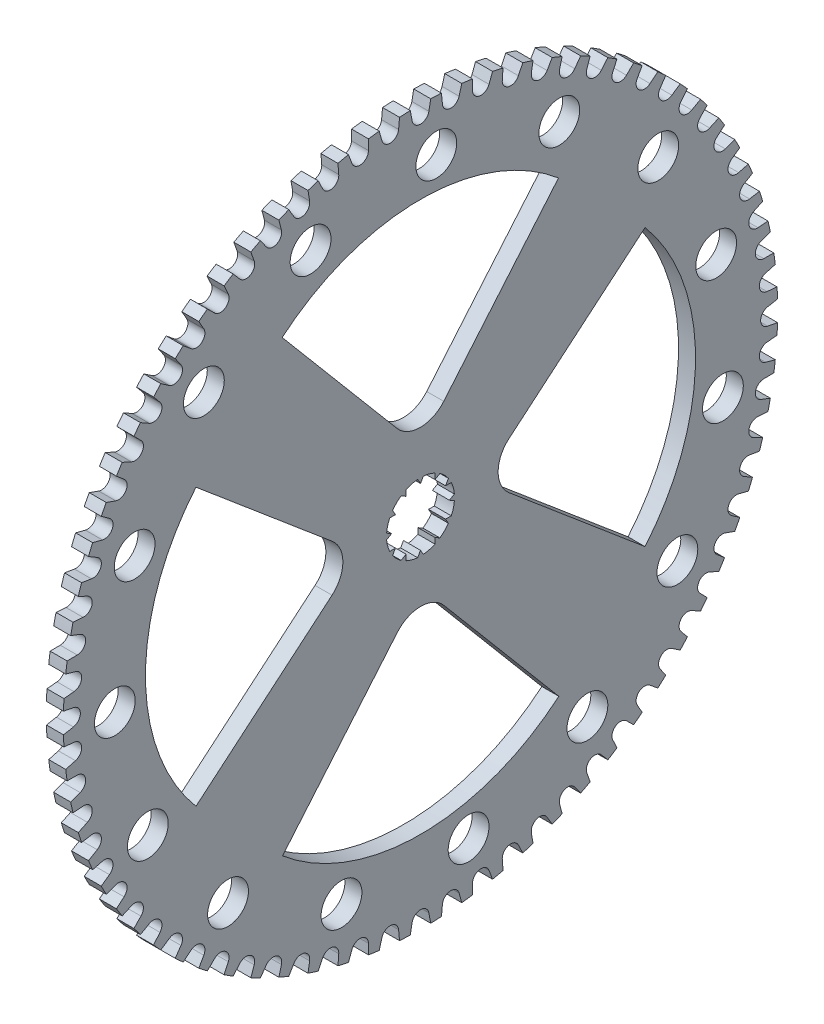
from build123d import *

# Parameters (mm, degrees)
SKETCH1_R               = 105
BOSS_EXTRUDE1_DEPTH     = 5
CUT_EXTRUDE4_DEPTH      = 10
CUT_EXTRUDE2_DEPTH      = 134
CUT_EXTRUDE2_DEPTH_BACK = 36
CUT_EXTRUDE3_DEPTH      = 43
CUT_EXTRUDE3_DEPTH_BACK = 16
SKETCH5_R               = 6


with BuildPart() as part:
    # Sketch1 → Boss-Extrude1 (new body)
    with BuildSketch(Plane(origin=(0, 0, 0), x_dir=(0, 0, -1), z_dir=(1, 0, 0))):
        Circle(SKETCH1_R)
    extrude(amount=BOSS_EXTRUDE1_DEPTH)

    # Sketch3 → Cut-Extrude4 (cut)
    with BuildSketch(Plane.ZY):
        with BuildLine():
            Line((-2.45783116, 102.042762654), (-3, 104.957134107))
            ThreePointArc((-3, 104.957134107), (0, 105), (3, 104.957134107))
            Line((3, 104.957134107), (2.45783116, 102.042762654))
            ThreePointArc((2.45783116, 102.042762654), (0, 100), (-2.45783116, 102.042762654))
        make_face()
        with BuildLine():
            Line((6.445134401, 101.868673234), (6.159032886, 104.819207753))
            ThreePointArc((6.159032886, 104.819207753), (9.151352989, 104.6004433), (12.136201074, 104.296273296))
            Line((12.136201074, 104.296273296), (11.342091141, 101.440245034))
            ThreePointArc((11.342091141, 101.440245034), (8.715574275, 99.619469809), (6.445134401, 101.868673234))
        make_face()
        with BuildLine():
            Line((15.299048597, 100.919301702), (15.271191812, 103.883543936))
            ThreePointArc((15.271191812, 103.883543936), (18.233058655, 103.404814066), (21.18003833, 102.84165487))
            Line((21.18003833, 102.84165487), (20.14003096, 100.065705898))
            ThreePointArc((20.14003096, 100.065705898), (17.364817767, 98.480775301), (15.299048597, 100.919301702))
        make_face()
        with BuildLine():
            Line((24.036527796, 99.201873347), (24.267127747, 102.157263623))
            ThreePointArc((24.267127747, 102.157263623), (27.175999736, 101.42221176), (30.062682705, 100.604349352))
            Line((30.062682705, 100.604349352), (28.784692983, 97.929606319))
            ThreePointArc((28.784692983, 97.929606319), (25.88190451, 96.592582629), (24.036527796, 99.201873347))
        make_face()
        with BuildLine():
            Line((32.591074504, 96.729458836), (33.078376188, 99.653504849))
            ThreePointArc((33.078376188, 99.653504849), (35.912115049, 98.667725183), (38.716531913, 97.601383989))
            Line((38.716531913, 97.601383989), (37.210286112, 95.048203305))
            ThreePointArc((37.210286112, 95.048203305), (34.202014333, 93.969262079), (32.591074504, 96.729458836))
        make_face()
        with BuildLine():
            Line((40.897583457, 93.520874736), (41.637878213, 96.391322732))
            ThreePointArc((41.637878213, 96.391322732), (44.374917483, 95.162317639), (47.075724935, 93.855613161))
            Line((47.075724935, 93.855613161), (45.352686495, 91.443426071))
            ThreePointArc((45.352686495, 91.443426071), (42.261826174, 90.630778704), (40.897583457, 93.520874736))
        make_face()
        with BuildLine():
            Line((48.892837104, 89.60054031), (49.880490842, 92.395544445))
            ThreePointArc((49.880490842, 92.395544445), (52.5, 90.932667397), (55.076643265, 89.395544445))
            Line((55.076643265, 89.395544445), (53.149925549, 87.142709151))
            ThreePointArc((53.149925549, 87.142709151), (50, 86.602540378), (48.892837104, 89.60054031))
        make_face()
        with BuildLine():
            Line((56.515986739, 84.99829167), (57.743482818, 87.696580276))
            ThreePointArc((57.743482818, 87.696580276), (60.225525817, 86.01096465), (62.658395084, 84.255121658))
            Line((62.658395084, 84.255121658), (60.542661577, 82.178783595))
            ThreePointArc((60.542661577, 82.178783595), (57.357643635, 81.915204429), (56.515986739, 84.99829167))
        make_face()
        with BuildLine():
            Line((63.70901559, 79.749154707), (65.167012023, 82.330192178))
            ThreePointArc((65.167012023, 82.330192178), (67.492699017, 80.434666527), (69.763278682, 78.473466519))
            Line((69.763278682, 78.473466519), (67.474631394, 76.589427875))
            ThreePointArc((67.474631394, 76.589427875), (64.278760969, 76.604444312), (63.70901559, 79.749154707))
        make_face()
        with BuildLine():
            Line((70.417180363, 73.893078523), (72.094580918, 76.337221605))
            ThreePointArc((72.094580918, 76.337221605), (74.246212025, 74.246212025), (76.337221605, 72.094580918))
            Line((76.337221605, 72.094580918), (73.893078523, 70.417180363))
            ThreePointArc((73.893078523, 70.417180363), (70.710678119, 70.710678119), (70.417180363, 73.893078523))
        make_face()
        with BuildLine():
            Line((76.589427875, 67.474631394), (78.473466519, 69.763278682))
            ThreePointArc((78.473466519, 69.763278682), (80.434666527, 67.492699017), (82.330192178, 65.167012023))
            Line((82.330192178, 65.167012023), (79.749154707, 63.70901559))
            ThreePointArc((79.749154707, 63.70901559), (76.604444312, 64.278760969), (76.589427875, 67.474631394))
        make_face()
        with BuildLine():
            Line((82.178783595, 60.542661577), (84.255121658, 62.658395084))
            ThreePointArc((84.255121658, 62.658395084), (86.01096465, 60.225525817), (87.696580276, 57.743482818))
            Line((87.696580276, 57.743482818), (84.99829167, 56.515986739))
            ThreePointArc((84.99829167, 56.515986739), (81.915204429, 57.357643635), (82.178783595, 60.542661577))
        make_face()
        with BuildLine():
            Line((87.142709151, 53.149925549), (89.395544445, 55.076643265))
            ThreePointArc((89.395544445, 55.076643265), (90.932667397, 52.5), (92.395544445, 49.880490842))
            Line((92.395544445, 49.880490842), (89.60054031, 48.892837104))
            ThreePointArc((89.60054031, 48.892837104), (86.602540378, 50), (87.142709151, 53.149925549))
        make_face()
        with BuildLine():
            Line((91.443426071, 45.352686495), (93.855613161, 47.075724935))
            ThreePointArc((93.855613161, 47.075724935), (95.162317639, 44.374917483), (96.391322732, 41.637878213))
            Line((96.391322732, 41.637878213), (93.520874736, 40.897583457))
            ThreePointArc((93.520874736, 40.897583457), (90.630778704, 42.261826174), (91.443426071, 45.352686495))
        make_face()
        with BuildLine():
            Line((95.048203305, 37.210286112), (97.601383989, 38.716531913))
            ThreePointArc((97.601383989, 38.716531913), (98.667725183, 35.912115049), (99.653504849, 33.078376188))
            Line((99.653504849, 33.078376188), (96.729458836, 32.591074504))
            ThreePointArc((96.729458836, 32.591074504), (93.969262079, 34.202014333), (95.048203305, 37.210286112))
        make_face()
        with BuildLine():
            Line((97.929606319, 28.784692983), (100.604349352, 30.062682705))
            ThreePointArc((100.604349352, 30.062682705), (101.42221176, 27.175999736), (102.157263623, 24.267127747))
            Line((102.157263623, 24.267127747), (99.201873347, 24.036527796))
            ThreePointArc((99.201873347, 24.036527796), (96.592582629, 25.88190451), (97.929606319, 28.784692983))
        make_face()
        with BuildLine():
            Line((100.065705898, 20.14003096), (102.84165487, 21.18003833))
            ThreePointArc((102.84165487, 21.18003833), (103.404814066, 18.233058655), (103.883543936, 15.271191812))
            Line((103.883543936, 15.271191812), (100.919301702, 15.299048597))
            ThreePointArc((100.919301702, 15.299048597), (98.480775301, 17.364817767), (100.065705898, 20.14003096))
        make_face()
        with BuildLine():
            Line((101.440245034, 11.342091141), (104.296273296, 12.136201074))
            ThreePointArc((104.296273296, 12.136201074), (104.6004433, 9.151352989), (104.819207753, 6.159032886))
            Line((104.819207753, 6.159032886), (101.868673234, 6.445134401))
            ThreePointArc((101.868673234, 6.445134401), (99.619469809, 8.715574275), (101.440245034, 11.342091141))
        make_face()
        with BuildLine():
            Line((102.042762654, 2.45783116), (104.957134107, 3))
            ThreePointArc((104.957134107, 3), (105, 0), (104.957134107, -3))
            Line((104.957134107, -3), (102.042762654, -2.45783116))
            ThreePointArc((102.042762654, -2.45783116), (100, 0), (102.042762654, 2.45783116))
        make_face()
        with BuildLine():
            Line((101.868673234, -6.445134401), (104.819207753, -6.159032886))
            ThreePointArc((104.819207753, -6.159032886), (104.6004433, -9.151352989), (104.296273296, -12.136201074))
            Line((104.296273296, -12.136201074), (101.440245034, -11.342091141))
            ThreePointArc((101.440245034, -11.342091141), (99.619469809, -8.715574275), (101.868673234, -6.445134401))
        make_face()
        with BuildLine():
            Line((100.919301702, -15.299048597), (103.883543936, -15.271191812))
            ThreePointArc((103.883543936, -15.271191812), (103.404814066, -18.233058655), (102.84165487, -21.18003833))
            Line((102.84165487, -21.18003833), (100.065705898, -20.14003096))
            ThreePointArc((100.065705898, -20.14003096), (98.480775301, -17.364817767), (100.919301702, -15.299048597))
        make_face()
        with BuildLine():
            Line((99.201873347, -24.036527796), (102.157263623, -24.267127747))
            ThreePointArc((102.157263623, -24.267127747), (101.42221176, -27.175999736), (100.604349352, -30.062682705))
            Line((100.604349352, -30.062682705), (97.929606319, -28.784692983))
            ThreePointArc((97.929606319, -28.784692983), (96.592582629, -25.88190451), (99.201873347, -24.036527796))
        make_face()
        with BuildLine():
            Line((96.729458836, -32.591074504), (99.653504849, -33.078376188))
            ThreePointArc((99.653504849, -33.078376188), (98.667725183, -35.912115049), (97.601383989, -38.716531913))
            Line((97.601383989, -38.716531913), (95.048203305, -37.210286112))
            ThreePointArc((95.048203305, -37.210286112), (93.969262079, -34.202014333), (96.729458836, -32.591074504))
        make_face()
        with BuildLine():
            Line((93.520874736, -40.897583457), (96.391322732, -41.637878213))
            ThreePointArc((96.391322732, -41.637878213), (95.162317639, -44.374917483), (93.855613161, -47.075724935))
            Line((93.855613161, -47.075724935), (91.443426071, -45.352686495))
            ThreePointArc((91.443426071, -45.352686495), (90.630778704, -42.261826174), (93.520874736, -40.897583457))
        make_face()
        with BuildLine():
            Line((89.60054031, -48.892837104), (92.395544445, -49.880490842))
            ThreePointArc((92.395544445, -49.880490842), (90.932667397, -52.5), (89.395544445, -55.076643265))
            Line((89.395544445, -55.076643265), (87.142709151, -53.149925549))
            ThreePointArc((87.142709151, -53.149925549), (86.602540378, -50), (89.60054031, -48.892837104))
        make_face()
        with BuildLine():
            Line((84.99829167, -56.515986739), (87.696580276, -57.743482818))
            ThreePointArc((87.696580276, -57.743482818), (86.01096465, -60.225525817), (84.255121658, -62.658395084))
            Line((84.255121658, -62.658395084), (82.178783595, -60.542661577))
            ThreePointArc((82.178783595, -60.542661577), (81.915204429, -57.357643635), (84.99829167, -56.515986739))
        make_face()
        with BuildLine():
            Line((79.749154707, -63.70901559), (82.330192178, -65.167012023))
            ThreePointArc((82.330192178, -65.167012023), (80.434666527, -67.492699017), (78.473466519, -69.763278682))
            Line((78.473466519, -69.763278682), (76.589427875, -67.474631394))
            ThreePointArc((76.589427875, -67.474631394), (76.604444312, -64.278760969), (79.749154707, -63.70901559))
        make_face()
        with BuildLine():
            Line((73.893078523, -70.417180363), (76.337221605, -72.094580918))
            ThreePointArc((76.337221605, -72.094580918), (74.246212025, -74.246212025), (72.094580918, -76.337221605))
            Line((72.094580918, -76.337221605), (70.417180363, -73.893078523))
            ThreePointArc((70.417180363, -73.893078523), (70.710678119, -70.710678119), (73.893078523, -70.417180363))
        make_face()
        with BuildLine():
            Line((67.474631394, -76.589427875), (69.763278682, -78.473466519))
            ThreePointArc((69.763278682, -78.473466519), (67.492699017, -80.434666527), (65.167012023, -82.330192178))
            Line((65.167012023, -82.330192178), (63.70901559, -79.749154707))
            ThreePointArc((63.70901559, -79.749154707), (64.278760969, -76.604444312), (67.474631394, -76.589427875))
        make_face()
        with BuildLine():
            Line((60.542661577, -82.178783595), (62.658395084, -84.255121658))
            ThreePointArc((62.658395084, -84.255121658), (60.225525817, -86.01096465), (57.743482818, -87.696580276))
            Line((57.743482818, -87.696580276), (56.515986739, -84.99829167))
            ThreePointArc((56.515986739, -84.99829167), (57.357643635, -81.915204429), (60.542661577, -82.178783595))
        make_face()
        with BuildLine():
            Line((53.149925549, -87.142709151), (55.076643265, -89.395544445))
            ThreePointArc((55.076643265, -89.395544445), (52.5, -90.932667397), (49.880490842, -92.395544445))
            Line((49.880490842, -92.395544445), (48.892837104, -89.60054031))
            ThreePointArc((48.892837104, -89.60054031), (50, -86.602540378), (53.149925549, -87.142709151))
        make_face()
        with BuildLine():
            Line((45.352686495, -91.443426071), (47.075724935, -93.855613161))
            ThreePointArc((47.075724935, -93.855613161), (44.374917483, -95.162317639), (41.637878213, -96.391322732))
            Line((41.637878213, -96.391322732), (40.897583457, -93.520874736))
            ThreePointArc((40.897583457, -93.520874736), (42.261826174, -90.630778704), (45.352686495, -91.443426071))
        make_face()
        with BuildLine():
            Line((37.210286112, -95.048203305), (38.716531913, -97.601383989))
            ThreePointArc((38.716531913, -97.601383989), (35.912115049, -98.667725183), (33.078376188, -99.653504849))
            Line((33.078376188, -99.653504849), (32.591074504, -96.729458836))
            ThreePointArc((32.591074504, -96.729458836), (34.202014333, -93.969262079), (37.210286112, -95.048203305))
        make_face()
        with BuildLine():
            Line((28.784692983, -97.929606319), (30.062682705, -100.604349352))
            ThreePointArc((30.062682705, -100.604349352), (27.175999736, -101.42221176), (24.267127747, -102.157263623))
            Line((24.267127747, -102.157263623), (24.036527796, -99.201873347))
            ThreePointArc((24.036527796, -99.201873347), (25.88190451, -96.592582629), (28.784692983, -97.929606319))
        make_face()
        with BuildLine():
            Line((20.14003096, -100.065705898), (21.18003833, -102.84165487))
            ThreePointArc((21.18003833, -102.84165487), (18.233058655, -103.404814066), (15.271191812, -103.883543936))
            Line((15.271191812, -103.883543936), (15.299048597, -100.919301702))
            ThreePointArc((15.299048597, -100.919301702), (17.364817767, -98.480775301), (20.14003096, -100.065705898))
        make_face()
        with BuildLine():
            Line((11.342091141, -101.440245034), (12.136201074, -104.296273296))
            ThreePointArc((12.136201074, -104.296273296), (9.151352989, -104.6004433), (6.159032886, -104.819207753))
            Line((6.159032886, -104.819207753), (6.445134401, -101.868673234))
            ThreePointArc((6.445134401, -101.868673234), (8.715574275, -99.619469809), (11.342091141, -101.440245034))
        make_face()
        with BuildLine():
            Line((2.45783116, -102.042762654), (3, -104.957134107))
            ThreePointArc((3, -104.957134107), (0, -105), (-3, -104.957134107))
            Line((-3, -104.957134107), (-2.45783116, -102.042762654))
            ThreePointArc((-2.45783116, -102.042762654), (0, -100), (2.45783116, -102.042762654))
        make_face()
        with BuildLine():
            Line((-6.445134401, -101.868673234), (-6.159032886, -104.819207753))
            ThreePointArc((-6.159032886, -104.819207753), (-9.151352989, -104.6004433), (-12.136201074, -104.296273296))
            Line((-12.136201074, -104.296273296), (-11.342091141, -101.440245034))
            ThreePointArc((-11.342091141, -101.440245034), (-8.715574275, -99.619469809), (-6.445134401, -101.868673234))
        make_face()
        with BuildLine():
            Line((-15.299048597, -100.919301702), (-15.271191812, -103.883543936))
            ThreePointArc((-15.271191812, -103.883543936), (-18.233058655, -103.404814066), (-21.18003833, -102.84165487))
            Line((-21.18003833, -102.84165487), (-20.14003096, -100.065705898))
            ThreePointArc((-20.14003096, -100.065705898), (-17.364817767, -98.480775301), (-15.299048597, -100.919301702))
        make_face()
        with BuildLine():
            Line((-24.036527796, -99.201873347), (-24.267127747, -102.157263623))
            ThreePointArc((-24.267127747, -102.157263623), (-27.175999736, -101.42221176), (-30.062682705, -100.604349352))
            Line((-30.062682705, -100.604349352), (-28.784692983, -97.929606319))
            ThreePointArc((-28.784692983, -97.929606319), (-25.88190451, -96.592582629), (-24.036527796, -99.201873347))
        make_face()
        with BuildLine():
            Line((-32.591074504, -96.729458836), (-33.078376188, -99.653504849))
            ThreePointArc((-33.078376188, -99.653504849), (-35.912115049, -98.667725183), (-38.716531913, -97.601383989))
            Line((-38.716531913, -97.601383989), (-37.210286112, -95.048203305))
            ThreePointArc((-37.210286112, -95.048203305), (-34.202014333, -93.969262079), (-32.591074504, -96.729458836))
        make_face()
        with BuildLine():
            Line((-40.897583457, -93.520874736), (-41.637878213, -96.391322732))
            ThreePointArc((-41.637878213, -96.391322732), (-44.374917483, -95.162317639), (-47.075724935, -93.855613161))
            Line((-47.075724935, -93.855613161), (-45.352686495, -91.443426071))
            ThreePointArc((-45.352686495, -91.443426071), (-42.261826174, -90.630778704), (-40.897583457, -93.520874736))
        make_face()
        with BuildLine():
            Line((-48.892837104, -89.60054031), (-49.880490842, -92.395544445))
            ThreePointArc((-49.880490842, -92.395544445), (-52.5, -90.932667397), (-55.076643265, -89.395544445))
            Line((-55.076643265, -89.395544445), (-53.149925549, -87.142709151))
            ThreePointArc((-53.149925549, -87.142709151), (-50, -86.602540378), (-48.892837104, -89.60054031))
        make_face()
        with BuildLine():
            Line((-56.515986739, -84.99829167), (-57.743482818, -87.696580276))
            ThreePointArc((-57.743482818, -87.696580276), (-60.225525817, -86.01096465), (-62.658395084, -84.255121658))
            Line((-62.658395084, -84.255121658), (-60.542661577, -82.178783595))
            ThreePointArc((-60.542661577, -82.178783595), (-57.357643635, -81.915204429), (-56.515986739, -84.99829167))
        make_face()
        with BuildLine():
            Line((-63.70901559, -79.749154707), (-65.167012023, -82.330192178))
            ThreePointArc((-65.167012023, -82.330192178), (-67.492699017, -80.434666527), (-69.763278682, -78.473466519))
            Line((-69.763278682, -78.473466519), (-67.474631394, -76.589427875))
            ThreePointArc((-67.474631394, -76.589427875), (-64.278760969, -76.604444312), (-63.70901559, -79.749154707))
        make_face()
        with BuildLine():
            Line((-70.417180363, -73.893078523), (-72.094580918, -76.337221605))
            ThreePointArc((-72.094580918, -76.337221605), (-74.246212025, -74.246212025), (-76.337221605, -72.094580918))
            Line((-76.337221605, -72.094580918), (-73.893078523, -70.417180363))
            ThreePointArc((-73.893078523, -70.417180363), (-70.710678119, -70.710678119), (-70.417180363, -73.893078523))
        make_face()
        with BuildLine():
            Line((-76.589427875, -67.474631394), (-78.473466519, -69.763278682))
            ThreePointArc((-78.473466519, -69.763278682), (-80.434666527, -67.492699017), (-82.330192178, -65.167012023))
            Line((-82.330192178, -65.167012023), (-79.749154707, -63.70901559))
            ThreePointArc((-79.749154707, -63.70901559), (-76.604444312, -64.278760969), (-76.589427875, -67.474631394))
        make_face()
        with BuildLine():
            Line((-82.178783595, -60.542661577), (-84.255121658, -62.658395084))
            ThreePointArc((-84.255121658, -62.658395084), (-86.01096465, -60.225525817), (-87.696580276, -57.743482818))
            Line((-87.696580276, -57.743482818), (-84.99829167, -56.515986739))
            ThreePointArc((-84.99829167, -56.515986739), (-81.915204429, -57.357643635), (-82.178783595, -60.542661577))
        make_face()
        with BuildLine():
            Line((-87.142709151, -53.149925549), (-89.395544445, -55.076643265))
            ThreePointArc((-89.395544445, -55.076643265), (-90.932667397, -52.5), (-92.395544445, -49.880490842))
            Line((-92.395544445, -49.880490842), (-89.60054031, -48.892837104))
            ThreePointArc((-89.60054031, -48.892837104), (-86.602540378, -50), (-87.142709151, -53.149925549))
        make_face()
        with BuildLine():
            Line((-91.443426071, -45.352686495), (-93.855613161, -47.075724935))
            ThreePointArc((-93.855613161, -47.075724935), (-95.162317639, -44.374917483), (-96.391322732, -41.637878213))
            Line((-96.391322732, -41.637878213), (-93.520874736, -40.897583457))
            ThreePointArc((-93.520874736, -40.897583457), (-90.630778704, -42.261826174), (-91.443426071, -45.352686495))
        make_face()
        with BuildLine():
            Line((-95.048203305, -37.210286112), (-97.601383989, -38.716531913))
            ThreePointArc((-97.601383989, -38.716531913), (-98.667725183, -35.912115049), (-99.653504849, -33.078376188))
            Line((-99.653504849, -33.078376188), (-96.729458836, -32.591074504))
            ThreePointArc((-96.729458836, -32.591074504), (-93.969262079, -34.202014333), (-95.048203305, -37.210286112))
        make_face()
        with BuildLine():
            Line((-97.929606319, -28.784692983), (-100.604349352, -30.062682705))
            ThreePointArc((-100.604349352, -30.062682705), (-101.42221176, -27.175999736), (-102.157263623, -24.267127747))
            Line((-102.157263623, -24.267127747), (-99.201873347, -24.036527796))
            ThreePointArc((-99.201873347, -24.036527796), (-96.592582629, -25.88190451), (-97.929606319, -28.784692983))
        make_face()
        with BuildLine():
            Line((-100.065705898, -20.14003096), (-102.84165487, -21.18003833))
            ThreePointArc((-102.84165487, -21.18003833), (-103.404814066, -18.233058655), (-103.883543936, -15.271191812))
            Line((-103.883543936, -15.271191812), (-100.919301702, -15.299048597))
            ThreePointArc((-100.919301702, -15.299048597), (-98.480775301, -17.364817767), (-100.065705898, -20.14003096))
        make_face()
        with BuildLine():
            Line((-101.440245034, -11.342091141), (-104.296273296, -12.136201074))
            ThreePointArc((-104.296273296, -12.136201074), (-104.6004433, -9.151352989), (-104.819207753, -6.159032886))
            Line((-104.819207753, -6.159032886), (-101.868673234, -6.445134401))
            ThreePointArc((-101.868673234, -6.445134401), (-99.619469809, -8.715574275), (-101.440245034, -11.342091141))
        make_face()
        with BuildLine():
            Line((-102.042762654, -2.45783116), (-104.957134107, -3))
            ThreePointArc((-104.957134107, -3), (-105, 0), (-104.957134107, 3))
            Line((-104.957134107, 3), (-102.042762654, 2.45783116))
            ThreePointArc((-102.042762654, 2.45783116), (-100, 0), (-102.042762654, -2.45783116))
        make_face()
        with BuildLine():
            Line((-101.868673234, 6.445134401), (-104.819207753, 6.159032886))
            ThreePointArc((-104.819207753, 6.159032886), (-104.6004433, 9.151352989), (-104.296273296, 12.136201074))
            Line((-104.296273296, 12.136201074), (-101.440245034, 11.342091141))
            ThreePointArc((-101.440245034, 11.342091141), (-99.619469809, 8.715574275), (-101.868673234, 6.445134401))
        make_face()
        with BuildLine():
            Line((-100.919301702, 15.299048597), (-103.883543936, 15.271191812))
            ThreePointArc((-103.883543936, 15.271191812), (-103.404814066, 18.233058655), (-102.84165487, 21.18003833))
            Line((-102.84165487, 21.18003833), (-100.065705898, 20.14003096))
            ThreePointArc((-100.065705898, 20.14003096), (-98.480775301, 17.364817767), (-100.919301702, 15.299048597))
        make_face()
        with BuildLine():
            Line((-99.201873347, 24.036527796), (-102.157263623, 24.267127747))
            ThreePointArc((-102.157263623, 24.267127747), (-101.42221176, 27.175999736), (-100.604349352, 30.062682705))
            Line((-100.604349352, 30.062682705), (-97.929606319, 28.784692983))
            ThreePointArc((-97.929606319, 28.784692983), (-96.592582629, 25.88190451), (-99.201873347, 24.036527796))
        make_face()
        with BuildLine():
            Line((-96.729458836, 32.591074504), (-99.653504849, 33.078376188))
            ThreePointArc((-99.653504849, 33.078376188), (-98.667725183, 35.912115049), (-97.601383989, 38.716531913))
            Line((-97.601383989, 38.716531913), (-95.048203305, 37.210286112))
            ThreePointArc((-95.048203305, 37.210286112), (-93.969262079, 34.202014333), (-96.729458836, 32.591074504))
        make_face()
        with BuildLine():
            Line((-93.520874736, 40.897583457), (-96.391322732, 41.637878213))
            ThreePointArc((-96.391322732, 41.637878213), (-95.162317639, 44.374917483), (-93.855613161, 47.075724935))
            Line((-93.855613161, 47.075724935), (-91.443426071, 45.352686495))
            ThreePointArc((-91.443426071, 45.352686495), (-90.630778704, 42.261826174), (-93.520874736, 40.897583457))
        make_face()
        with BuildLine():
            Line((-89.60054031, 48.892837104), (-92.395544445, 49.880490842))
            ThreePointArc((-92.395544445, 49.880490842), (-90.932667397, 52.5), (-89.395544445, 55.076643265))
            Line((-89.395544445, 55.076643265), (-87.142709151, 53.149925549))
            ThreePointArc((-87.142709151, 53.149925549), (-86.602540378, 50), (-89.60054031, 48.892837104))
        make_face()
        with BuildLine():
            Line((-84.99829167, 56.515986739), (-87.696580276, 57.743482818))
            ThreePointArc((-87.696580276, 57.743482818), (-86.01096465, 60.225525817), (-84.255121658, 62.658395084))
            Line((-84.255121658, 62.658395084), (-82.178783595, 60.542661577))
            ThreePointArc((-82.178783595, 60.542661577), (-81.915204429, 57.357643635), (-84.99829167, 56.515986739))
        make_face()
        with BuildLine():
            Line((-79.749154707, 63.70901559), (-82.330192178, 65.167012023))
            ThreePointArc((-82.330192178, 65.167012023), (-80.434666527, 67.492699017), (-78.473466519, 69.763278682))
            Line((-78.473466519, 69.763278682), (-76.589427875, 67.474631394))
            ThreePointArc((-76.589427875, 67.474631394), (-76.604444312, 64.278760969), (-79.749154707, 63.70901559))
        make_face()
        with BuildLine():
            Line((-73.893078523, 70.417180363), (-76.337221605, 72.094580918))
            ThreePointArc((-76.337221605, 72.094580918), (-74.246212025, 74.246212025), (-72.094580918, 76.337221605))
            Line((-72.094580918, 76.337221605), (-70.417180363, 73.893078523))
            ThreePointArc((-70.417180363, 73.893078523), (-70.710678119, 70.710678119), (-73.893078523, 70.417180363))
        make_face()
        with BuildLine():
            Line((-67.474631394, 76.589427875), (-69.763278682, 78.473466519))
            ThreePointArc((-69.763278682, 78.473466519), (-67.492699017, 80.434666527), (-65.167012023, 82.330192178))
            Line((-65.167012023, 82.330192178), (-63.70901559, 79.749154707))
            ThreePointArc((-63.70901559, 79.749154707), (-64.278760969, 76.604444312), (-67.474631394, 76.589427875))
        make_face()
        with BuildLine():
            Line((-60.542661577, 82.178783595), (-62.658395084, 84.255121658))
            ThreePointArc((-62.658395084, 84.255121658), (-60.225525817, 86.01096465), (-57.743482818, 87.696580276))
            Line((-57.743482818, 87.696580276), (-56.515986739, 84.99829167))
            ThreePointArc((-56.515986739, 84.99829167), (-57.357643635, 81.915204429), (-60.542661577, 82.178783595))
        make_face()
        with BuildLine():
            Line((-53.149925549, 87.142709151), (-55.076643265, 89.395544445))
            ThreePointArc((-55.076643265, 89.395544445), (-52.5, 90.932667397), (-49.880490842, 92.395544445))
            Line((-49.880490842, 92.395544445), (-48.892837104, 89.60054031))
            ThreePointArc((-48.892837104, 89.60054031), (-50, 86.602540378), (-53.149925549, 87.142709151))
        make_face()
        with BuildLine():
            Line((-45.352686495, 91.443426071), (-47.075724935, 93.855613161))
            ThreePointArc((-47.075724935, 93.855613161), (-44.374917483, 95.162317639), (-41.637878213, 96.391322732))
            Line((-41.637878213, 96.391322732), (-40.897583457, 93.520874736))
            ThreePointArc((-40.897583457, 93.520874736), (-42.261826174, 90.630778704), (-45.352686495, 91.443426071))
        make_face()
        with BuildLine():
            Line((-37.210286112, 95.048203305), (-38.716531913, 97.601383989))
            ThreePointArc((-38.716531913, 97.601383989), (-35.912115049, 98.667725183), (-33.078376188, 99.653504849))
            Line((-33.078376188, 99.653504849), (-32.591074504, 96.729458836))
            ThreePointArc((-32.591074504, 96.729458836), (-34.202014333, 93.969262079), (-37.210286112, 95.048203305))
        make_face()
        with BuildLine():
            Line((-28.784692983, 97.929606319), (-30.062682705, 100.604349352))
            ThreePointArc((-30.062682705, 100.604349352), (-27.175999736, 101.42221176), (-24.267127747, 102.157263623))
            Line((-24.267127747, 102.157263623), (-24.036527796, 99.201873347))
            ThreePointArc((-24.036527796, 99.201873347), (-25.88190451, 96.592582629), (-28.784692983, 97.929606319))
        make_face()
        with BuildLine():
            Line((-20.14003096, 100.065705898), (-21.18003833, 102.84165487))
            ThreePointArc((-21.18003833, 102.84165487), (-18.233058655, 103.404814066), (-15.271191812, 103.883543936))
            Line((-15.271191812, 103.883543936), (-15.299048597, 100.919301702))
            ThreePointArc((-15.299048597, 100.919301702), (-17.364817767, 98.480775301), (-20.14003096, 100.065705898))
        make_face()
        with BuildLine():
            Line((-11.342091141, 101.440245034), (-12.136201074, 104.296273296))
            ThreePointArc((-12.136201074, 104.296273296), (-9.151352989, 104.6004433), (-6.159032886, 104.819207753))
            Line((-6.159032886, 104.819207753), (-6.445134401, 101.868673234))
            ThreePointArc((-6.445134401, 101.868673234), (-8.715574275, 99.619469809), (-11.342091141, 101.440245034))
        make_face()
        with BuildLine():
            Line((-0.845358781, 9.96420436), (0, 8.5))
            Line((0, 8.5), (0.845358781, 9.96420436))
            ThreePointArc((0.845358781, 9.96420436), (2.588190451, 9.659258263), (4.25, 9.051933495))
            Line((4.25, 9.051933495), (4.25, 7.361215932))
            Line((4.25, 7.361215932), (5.71420436, 8.206574714))
            ThreePointArc((5.71420436, 8.206574714), (7.071067812, 7.071067812), (8.206574714, 5.71420436))
            Line((8.206574714, 5.71420436), (7.361215932, 4.25))
            Line((7.361215932, 4.25), (9.051933495, 4.25))
            ThreePointArc((9.051933495, 4.25), (9.659258263, 2.588190451), (9.96420436, 0.845358781))
            Line((9.96420436, 0.845358781), (8.5, 0))
            Line((8.5, 0), (9.96420436, -0.845358781))
            ThreePointArc((9.96420436, -0.845358781), (9.659258263, -2.588190451), (9.051933495, -4.25))
            Line((9.051933495, -4.25), (7.361215932, -4.25))
            Line((7.361215932, -4.25), (8.206574714, -5.71420436))
            ThreePointArc((8.206574714, -5.71420436), (7.071067812, -7.071067812), (5.71420436, -8.206574714))
            Line((5.71420436, -8.206574714), (4.25, -7.361215932))
            Line((4.25, -7.361215932), (4.25, -9.051933495))
            ThreePointArc((4.25, -9.051933495), (2.588190451, -9.659258263), (0.845358781, -9.96420436))
            Line((0.845358781, -9.96420436), (0, -8.5))
            Line((0, -8.5), (-0.845358781, -9.96420436))
            ThreePointArc((-0.845358781, -9.96420436), (-2.588190451, -9.659258263), (-4.25, -9.051933495))
            Line((-4.25, -9.051933495), (-4.25, -7.361215932))
            Line((-4.25, -7.361215932), (-5.71420436, -8.206574714))
            ThreePointArc((-5.71420436, -8.206574714), (-7.071067812, -7.071067812), (-8.206574714, -5.71420436))
            Line((-8.206574714, -5.71420436), (-7.361215932, -4.25))
            Line((-7.361215932, -4.25), (-9.051933495, -4.25))
            ThreePointArc((-9.051933495, -4.25), (-9.659258263, -2.588190451), (-9.96420436, -0.845358781))
            Line((-9.96420436, -0.845358781), (-8.5, 0))
            Line((-8.5, 0), (-9.96420436, 0.845358781))
            ThreePointArc((-9.96420436, 0.845358781), (-9.659258263, 2.588190451), (-9.051933495, 4.25))
            Line((-9.051933495, 4.25), (-7.361215932, 4.25))
            Line((-7.361215932, 4.25), (-8.206574714, 5.71420436))
            ThreePointArc((-8.206574714, 5.71420436), (-7.071067812, 7.071067812), (-5.71420436, 8.206574714))
            Line((-5.71420436, 8.206574714), (-4.25, 7.361215932))
            Line((-4.25, 7.361215932), (-4.25, 9.051933495))
            ThreePointArc((-4.25, 9.051933495), (-2.588190451, 9.659258263), (-0.845358781, 9.96420436))
        make_face()
    extrude(amount=-CUT_EXTRUDE4_DEPTH, mode=Mode.SUBTRACT)

    # Sketch4 → Cut-Extrude2 (cut, two sides: drawn at the far end of the back side and taken through both)
    with BuildSketch(Plane(origin=(0, 0, 0), x_dir=(0, 0, -1), z_dir=(1, 0, 0)).offset(-CUT_EXTRUDE2_DEPTH_BACK)):
        with BuildLine():
            Line((66.012603378, -40.570786289), (26.012603378, -6.82906199))
            ThreePointArc((26.012603378, -6.82906199), (22.815610391, 0.050262803), (26.012603378, 6.929587596))
            Line((26.012603378, 6.929587596), (66.012603378, 40.671311894))
            ThreePointArc((66.012603378, 40.671311894), (80.857329828, 0.050262803), (66.012603378, -40.570786289))
        make_face()
        with BuildLine():
            Line((-6.929587596, 26.012603378), (-40.671311894, 66.012603378))
            ThreePointArc((-40.671311894, 66.012603378), (-0.050262803, 80.857329828), (40.570786289, 66.012603378))
            Line((40.570786289, 66.012603378), (6.82906199, 26.012603378))
            ThreePointArc((6.82906199, 26.012603378), (-0.050262803, 22.815610391), (-6.929587596, 26.012603378))
        make_face()
        with BuildLine():
            Line((-40.570786289, -66.012603378), (-6.82906199, -26.012603378))
            ThreePointArc((-6.82906199, -26.012603378), (0.050262803, -22.815610391), (6.929587596, -26.012603378))
            Line((6.929587596, -26.012603378), (40.671311894, -66.012603378))
            ThreePointArc((40.671311894, -66.012603378), (0.050262803, -80.857329828), (-40.570786289, -66.012603378))
        make_face()
        with BuildLine():
            Line((-66.012603378, 40.570786289), (-26.012603378, 6.82906199))
            ThreePointArc((-26.012603378, 6.82906199), (-22.815610391, -0.050262803), (-26.012603378, -6.929587596))
            Line((-26.012603378, -6.929587596), (-66.012603378, -40.671311894))
            ThreePointArc((-66.012603378, -40.671311894), (-80.857329828, -0.050262803), (-66.012603378, 40.570786289))
        make_face()
    extrude(amount=CUT_EXTRUDE2_DEPTH + CUT_EXTRUDE2_DEPTH_BACK, mode=Mode.SUBTRACT)

    # Sketch5 → Cut-Extrude3 (cut, two sides: drawn at the far end of the back side and taken through both)
    with BuildSketch(Plane(origin=(0, 0, 0), x_dir=(0, 0, -1), z_dir=(1, 0, 0)).offset(-CUT_EXTRUDE3_DEPTH_BACK)):
        with Locations((-84.045309799, 32.192947997)):
            Circle(SKETCH5_R)
        with Locations((-63.685159404, 63.594028585)):
            Circle(SKETCH5_R)
        with Locations((-32.313266387, 83.999123897)):
            Circle(SKETCH5_R)
        with Locations((4.645883946, 89.880007579)):
            Circle(SKETCH5_R)
        with Locations((40.801718737, 80.219821416)):
            Circle(SKETCH5_R)
        with Locations((69.902565688, 56.688899357)):
            Circle(SKETCH5_R)
        with Locations((86.916623986, 23.355951596)):
            Circle(SKETCH5_R)
        with Locations((88.902008384, -14.015452378)):
            Circle(SKETCH5_R)
        with Locations((75.515427883, -48.963457309)):
            Circle(SKETCH5_R)
        with Locations((49.071543865, -75.445235653)):
            Circle(SKETCH5_R)
        with Locations((14.142744112, -88.881847354)):
            Circle(SKETCH5_R)
        with Locations((-23.231464581, -86.949980181)):
            Circle(SKETCH5_R)
        with Locations((-56.588741997, -69.983671519)):
            Circle(SKETCH5_R)
        with Locations((-80.161311828, -40.916550269)):
            Circle(SKETCH5_R)
        with Locations((-89.873262602, -4.774585763)):
            Circle(SKETCH5_R)
    extrude(amount=CUT_EXTRUDE3_DEPTH + CUT_EXTRUDE3_DEPTH_BACK, mode=Mode.SUBTRACT)


solid = part.part
